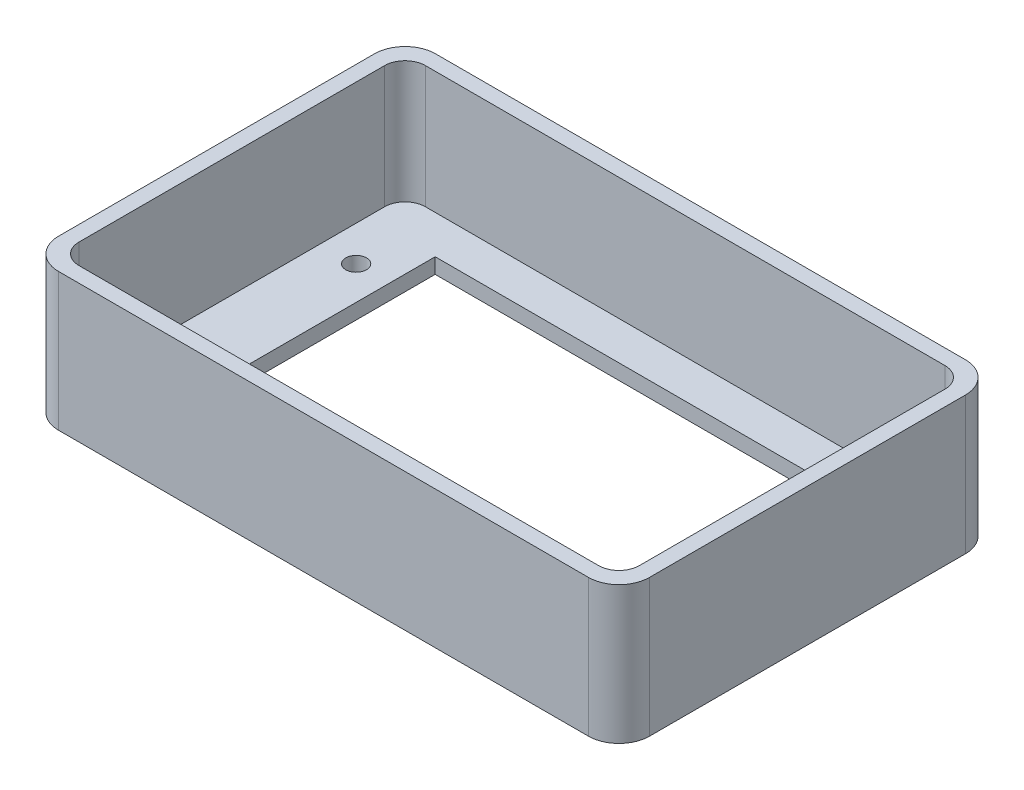
from build123d import *

# Parameters (mm, degrees)
SKETCH1_W           = 147.32
SKETCH1_H           = 93.98
SKETCH1_W_2         = 139.7
SKETCH1_H_2         = 86.36
BOSS_EXTRUDE1_DEPTH = 30.48
SKETCH2_W           = 147.32
SKETCH2_H           = 93.98
BOSS_EXTRUDE2_DEPTH = 3.81
FILLET1_R           = 7.62
FILLET2_R           = 5.08
CUT_EXTRUDE2_REACH  = 95.86
SKETCH4_W           = 105.5116
SKETCH4_H           = 67.2084
CUT_EXTRUDE3_REACH  = 94.536
SKETCH5_R           = 2.58


with BuildPart() as part:
    # Sketch1 → Boss-Extrude1 (new body)
    with BuildSketch(Plane(origin=(0, 0, 0), x_dir=(1, 0, 0), z_dir=(0, 1, 0))):
        Rectangle(SKETCH1_W, SKETCH1_H)
        Rectangle(SKETCH1_W_2, SKETCH1_H_2, mode=Mode.SUBTRACT)
    extrude(amount=BOSS_EXTRUDE1_DEPTH)

    # Sketch2 → Boss-Extrude2 (add)
    with BuildSketch(Plane(origin=(0, 0, 0), x_dir=(-1, 0, 0), z_dir=(0, -1, 0))):
        Rectangle(SKETCH2_W, SKETCH2_H)
    extrude(amount=BOSS_EXTRUDE2_DEPTH)

    # Fillet1
    fillet1_edges = [part.edges().sort_by_distance(p)[0] for p in [
        (-73.66, 13.335, -46.99),
        (73.66, 13.335, -46.99),
        (73.66, 13.335, 46.99),
        (-73.66, 13.335, 46.99),
    ]]
    fillet(fillet1_edges, radius=FILLET1_R)

    # Fillet2
    fillet2_edges = [part.edges().sort_by_distance(p)[0] for p in [
        (-69.85, 15.24, -43.18),
        (-69.85, 15.24, 43.18),
        (69.85, 15.24, 43.18),
        (69.85, 15.24, -43.18),
    ]]
    fillet(fillet2_edges, radius=FILLET2_R)

    # Sketch4 → Cut-Extrude2 (cut, up to next)
    with BuildSketch(Plane.XZ.offset(3.81), mode=Mode.PRIVATE) as cut_extrude2_sk1:
        Rectangle(SKETCH4_W, SKETCH4_H)
    cut_extrude2_tool1 = extrude(cut_extrude2_sk1.sketch, amount=-CUT_EXTRUDE2_REACH, mode=Mode.PRIVATE) & part.part
    add(cut_extrude2_tool1.solids().sort_by_distance((0, -3.81, 0))[0], mode=Mode.SUBTRACT)

    # Sketch5 → Cut-Extrude3 (cut, up to next)
    with BuildSketch(Plane(origin=(0, 0, 0), x_dir=(1, 0, 0), z_dir=(0, 1, 0)), mode=Mode.PRIVATE) as cut_extrude3_sk1:
        with Locations(Location((-61.0842, -22.2208, 0), (0, 0, 270))):
            Circle(SKETCH5_R)
    cut_extrude3_tool1 = extrude(cut_extrude3_sk1.sketch, amount=-CUT_EXTRUDE3_REACH, mode=Mode.PRIVATE) & part.part
    # Sketch5 → Cut-Extrude3 (cut, up to next)
    with BuildSketch(Plane(origin=(0, 0, 0), x_dir=(1, 0, 0), z_dir=(0, 1, 0)), mode=Mode.PRIVATE) as cut_extrude3_sk2:
        with Locations(Location((61.0958, -22.2208, 0), (0, 0, 270))):
            Circle(SKETCH5_R)
    cut_extrude3_tool2 = extrude(cut_extrude3_sk2.sketch, amount=-CUT_EXTRUDE3_REACH, mode=Mode.PRIVATE) & part.part
    # Sketch5 → Cut-Extrude3 (cut, up to next)
    with BuildSketch(Plane(origin=(0, 0, 0), x_dir=(1, 0, 0), z_dir=(0, 1, 0)), mode=Mode.PRIVATE) as cut_extrude3_sk3:
        with Locations(Location((61.0958, 22.2292, 0), (0, 0, 270))):
            Circle(SKETCH5_R)
    cut_extrude3_tool3 = extrude(cut_extrude3_sk3.sketch, amount=-CUT_EXTRUDE3_REACH, mode=Mode.PRIVATE) & part.part
    # Sketch5 → Cut-Extrude3 (cut, up to next)
    with BuildSketch(Plane(origin=(0, 0, 0), x_dir=(1, 0, 0), z_dir=(0, 1, 0)), mode=Mode.PRIVATE) as cut_extrude3_sk4:
        with Locations(Location((-61.0842, 22.2292, 0), (0, 0, 270))):
            Circle(SKETCH5_R)
    cut_extrude3_tool4 = extrude(cut_extrude3_sk4.sketch, amount=-CUT_EXTRUDE3_REACH, mode=Mode.PRIVATE) & part.part
    add(cut_extrude3_tool1.solids().sort_by_distance((-61.0842, 0, 22.2208))[0], mode=Mode.SUBTRACT)
    add(cut_extrude3_tool2.solids().sort_by_distance((61.0958, 0, 22.2208))[0], mode=Mode.SUBTRACT)
    add(cut_extrude3_tool3.solids().sort_by_distance((61.0958, 0, -22.2292))[0], mode=Mode.SUBTRACT)
    add(cut_extrude3_tool4.solids().sort_by_distance((-61.0842, 0, -22.2292))[0], mode=Mode.SUBTRACT)


solid = part.part
